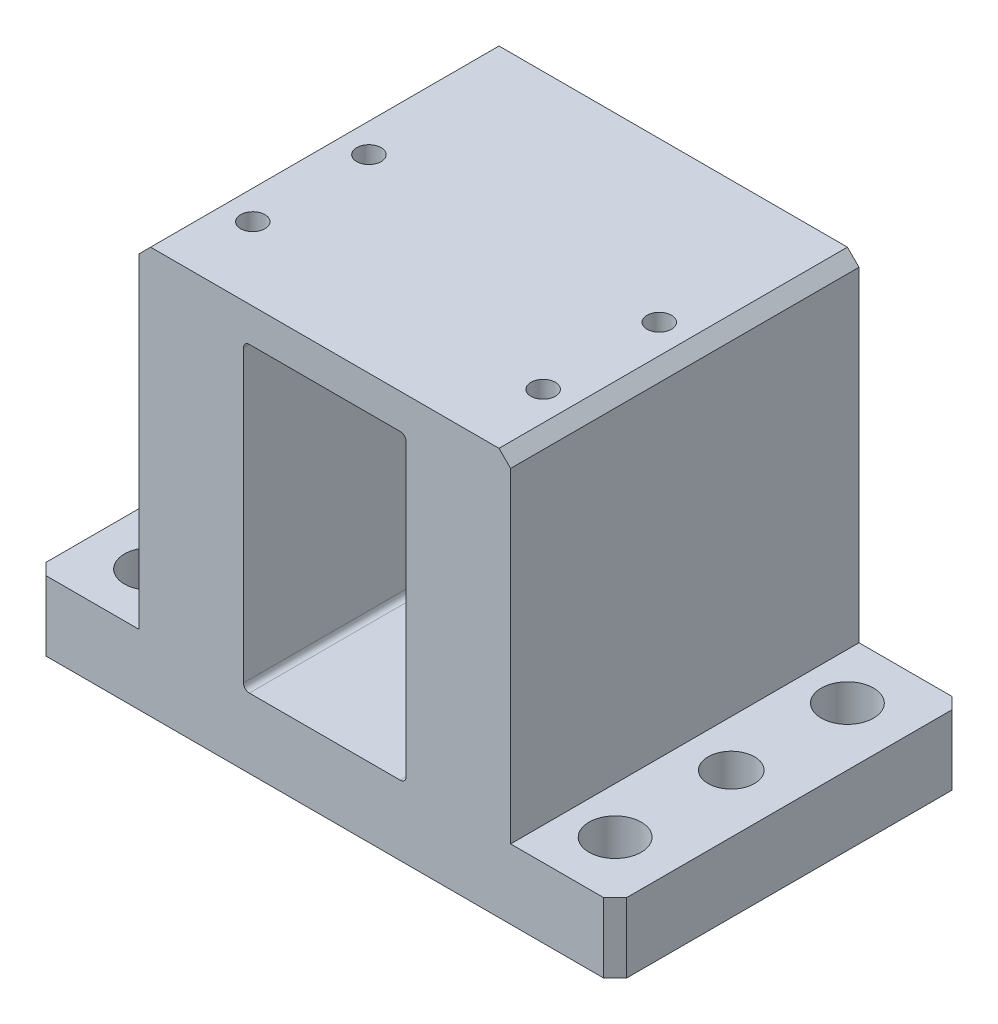
from build123d import *

# Parameters (mm, degrees)
SKETCH_1_W             = 100
SKETCH_1_H             = 70
EXTRUDE_1_DEPTH        = 30
SKETCH_2_W             = 18
SKETCH_2_H             = 60
CUT_EXTRUDE_1_DEPTH    = 58
HOLE_WIZARD_9_0_9_1_D  = 9
CUT_EXTRUDE_2_REACH    = 87.586
HOLE_WIZARD_8_0_8_1_D  = 8
HOLE_WIZARD_M5_1_D     = 4.2
HOLE_WIZARD_M5_1_DEPTH = 16
HOLE_WIZARD_M5_1_TIP   = 1.2618073
CHAMFER_1_SIZE         = 2


with BuildPart() as part:
    # 草圖1 → 伸長1 (new, symmetric)
    with BuildSketch(Plane.XY):
        Rectangle(SKETCH_1_W, SKETCH_1_H)
    extrude(amount=EXTRUDE_1_DEPTH, both=True)

    # 草圖2 → 除料-伸長1 (cut)
    with BuildSketch(Plane(origin=(0, 35, 0), x_dir=(1, 0, 0), z_dir=(0, 1, 0))):
        with Locations((41, 0)):
            Rectangle(SKETCH_2_W, SKETCH_2_H)
        with Locations((-41, 0)):
            Rectangle(SKETCH_2_W, SKETCH_2_H)
    extrude(amount=-CUT_EXTRUDE_1_DEPTH, mode=Mode.SUBTRACT)

    # Ø9.0 (9) 直徑孔1 (through all)
    with Locations(Plane(origin=(-40, -23, 55), x_dir=(-1, 0, 0), z_dir=(0, 1, 0))):
        with Locations((0, -75), (-80, -75), (-80, -35), (0, -35)):
            Hole(HOLE_WIZARD_9_0_9_1_D / 2)

    # 草圖17 → 除料-伸長2 (cut, up to next)
    with BuildSketch(Plane(origin=(0, 0, -30), x_dir=(-1, 0, 0), z_dir=(0, 0, -1)), mode=Mode.PRIVATE) as cut_extrude_2_sk1:
        with BuildLine():
            Line((13, -23), (-13, -23))
            ThreePointArc((-13, -23), (-13.707106781, -22.707106781), (-14, -22))
            Line((-14, -22), (-14, 28))
            ThreePointArc((-14, 28), (-13.707106781, 28.707106781), (-13, 29))
            Line((-13, 29), (13, 29))
            ThreePointArc((13, 29), (13.707106781, 28.707106781), (14, 28))
            Line((14, 28), (14, -22))
            ThreePointArc((14, -22), (13.707106781, -22.707106781), (13, -23))
        make_face()
    cut_extrude_2_tool1 = extrude(cut_extrude_2_sk1.sketch, amount=-CUT_EXTRUDE_2_REACH, mode=Mode.PRIVATE) & part.part
    add(cut_extrude_2_tool1.solids().sort_by_distance((0, 3, -30))[0], mode=Mode.SUBTRACT)

    # Ø8.0 (8) 直徑孔1 (through all)
    with Locations(Plane(origin=(20, -23, 5.325436893), x_dir=(-1, 0, 0), z_dir=(0, 1, 0))):
        with Locations((60, -5.325436893), (-20, -5.325436893)):
            Hole(HOLE_WIZARD_8_0_8_1_D / 2)

    # M5 螺紋孔1
    with Locations(Plane(origin=(0, 35, 0), x_dir=(-1, 0, 0), z_dir=(0, 1, 0))):
        with Locations((25, 17.4), (-25, 17.4), (-25, -2.6), (25, -2.6)):
            Hole(HOLE_WIZARD_M5_1_D / 2, depth=HOLE_WIZARD_M5_1_DEPTH)
            with Locations((0, 0, -(HOLE_WIZARD_M5_1_DEPTH + HOLE_WIZARD_M5_1_TIP / 2))):  # 118° drill point
                Cone(0, HOLE_WIZARD_M5_1_D / 2, HOLE_WIZARD_M5_1_TIP, mode=Mode.SUBTRACT)

    # 導角1
    chamfer_1_edges = [part.edges().sort_by_distance(p)[0] for p in [
        (50, -29, 30),
        (32, 35, 0),
        (-50, -29, -30),
        (-50, -29, 30),
        (-32, 35, 0),
        (50, -29, -30),
    ]]
    chamfer(chamfer_1_edges, length=CHAMFER_1_SIZE)


solid = part.part
